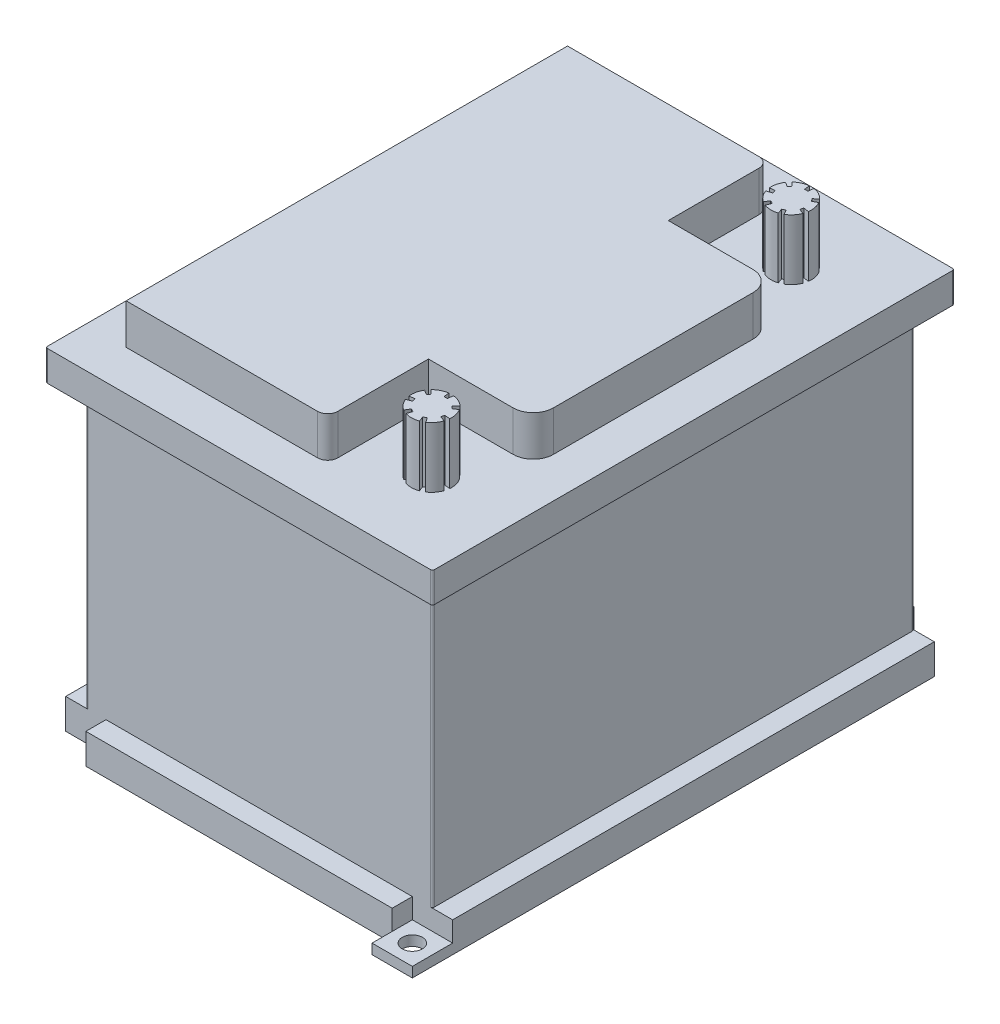
from build123d import *

# Parameters (mm, degrees)
SKETCH1_W           = 172
SKETCH1_H           = 239
BOSS_EXTRUDE1_DEPTH = 190
SKETCH2_W           = 172
SKETCH2_H           = 239
SKETCH2_W_2         = 152
SKETCH2_H_2         = 219
CUT_EXTRUDE1_DEPTH  = 20
SKETCH3_W           = 52
SKETCH3_H           = 50
CUT_EXTRUDE2_DEPTH  = 20
FILLET1_R           = 10
FILLET2_R           = 10
FILLET3_R           = 5
FILLET4_R           = 5
FILLET6_R           = 1
FILLET7_R           = 1
FILLET8_R           = 1
FILLET9_R           = 1
SKETCH4_R           = 10
BOSS_EXTRUDE4_DEPTH = 30
CUT_EXTRUDE8_START  = -30
CUT_EXTRUDE8_DEPTH  = 30
CUT_EXTRUDE9_START  = -30
CUT_EXTRUDE9_DEPTH  = 30
BOSS_EXTRUDE5_DEPTH = 15
SKETCH11_W          = 20
SKETCH11_H          = 10
CUT_EXTRUDE11_DEPTH = 15
SKETCH12_W          = 20
SKETCH12_H          = 5
BOSS_EXTRUDE6_DEPTH = 20
SKETCH13_R          = 5
CUT_EXTRUDE12_DEPTH = 20
SKETCH14_W          = 20
SKETCH14_H          = 5
BOSS_EXTRUDE7_DEPTH = 20
SKETCH15_R          = 5
CUT_EXTRUDE13_DEPTH = 20


with BuildPart() as part:
    # Sketch1 → Boss-Extrude1 (new body)
    with BuildSketch(Plane(origin=(0, 0, 0), x_dir=(1, 0, 0), z_dir=(0, 1, 0))):
        with Locations((116.427433091, -83.803086818)):
            Rectangle(SKETCH1_W, SKETCH1_H)
    extrude(amount=BOSS_EXTRUDE1_DEPTH)

    # Sketch2 → Cut-Extrude1 (cut)
    with BuildSketch(Plane(origin=(0, 190, 0), x_dir=(1, 0, 0), z_dir=(0, 1, 0))):
        with Locations((116.427433091, -83.803086818)):
            Rectangle(SKETCH2_W, SKETCH2_H)
        with Locations((116.427433091, -83.803086818)):
            Rectangle(SKETCH2_W_2, SKETCH2_H_2, mode=Mode.SUBTRACT)
    extrude(amount=-CUT_EXTRUDE1_DEPTH, mode=Mode.SUBTRACT)

    # Sketch3 → Cut-Extrude2 (cut)
    with BuildSketch(Plane(origin=(0, 190, 0), x_dir=(1, 0, 0), z_dir=(0, 1, 0))):
        with Locations((166.427433091, 0.696913182)):
            Rectangle(SKETCH3_W, SKETCH3_H)
        with Locations((166.427433091, -168.303086818)):
            Rectangle(SKETCH3_W, SKETCH3_H)
    extrude(amount=-CUT_EXTRUDE2_DEPTH, mode=Mode.SUBTRACT)

    # Fillet1
    fillet1_edges = [part.edges().sort_by_distance(p)[0] for p in [
        (192.427433091, 180, 24.303086818),
    ]]
    fillet(fillet1_edges, radius=FILLET1_R)

    # Fillet2
    fillet2_edges = [part.edges().sort_by_distance(p)[0] for p in [
        (192.427433091, 180, 143.303086818),
    ]]
    fillet(fillet2_edges, radius=FILLET2_R)

    # Fillet3
    fillet3_edges = [part.edges().sort_by_distance(p)[0] for p in [
        (140.427433091, 180, 193.303086818),
    ]]
    fillet(fillet3_edges, radius=FILLET3_R)

    # Fillet4
    fillet4_edges = [part.edges().sort_by_distance(p)[0] for p in [
        (140.427433091, 180, -25.696913182),
    ]]
    fillet(fillet4_edges, radius=FILLET4_R)

    # Fillet6
    fillet6_edges = [part.edges().sort_by_distance(p)[0] for p in [
        (30.427433091, 85, 203.303086818),
    ]]
    fillet(fillet6_edges, radius=FILLET6_R)

    # Fillet7
    fillet7_edges = [part.edges().sort_by_distance(p)[0] for p in [
        (202.427433091, 85, 203.303086818),
    ]]
    fillet(fillet7_edges, radius=FILLET7_R)

    # Fillet8
    fillet8_edges = [part.edges().sort_by_distance(p)[0] for p in [
        (202.427433091, 85, -35.696913182),
    ]]
    fillet(fillet8_edges, radius=FILLET8_R)

    # Fillet9
    fillet9_edges = [part.edges().sort_by_distance(p)[0] for p in [
        (30.427433091, 85, -35.696913182),
    ]]
    fillet(fillet9_edges, radius=FILLET9_R)

    # Sketch4 → Boss-Extrude4 (add)
    with BuildSketch(Plane(origin=(0, 170, 0), x_dir=(1, 0, 0), z_dir=(0, 1, 0))):
        with Locations(Location((171.427433091, -172.803086818, 0), (0, 0, 270))):
            Circle(SKETCH4_R)
        with Locations(Location((171.427433091, 5.696913182, 0), (0, 0, 270))):
            Circle(SKETCH4_R)
    extrude(amount=BOSS_EXTRUDE4_DEPTH)

    # Sketch7 → Cut-Extrude8 (cut)
    with BuildSketch(Plane(origin=(0, 200, 0), x_dir=(1, 0, 0), z_dir=(0, 1, 0)).offset(CUT_EXTRUDE8_START)):
        with BuildLine():
            Line((166.237215884, -167.741646234), (164.26810659, -165.821393323))
            ThreePointArc((164.26810659, -165.821393323), (163.503030714, -166.703591185), (162.846013112, -167.668962633))
            Line((162.846013112, -167.668962633), (165.181081901, -169.06599636))
            Line((165.181081901, -169.06599636), (166.237215884, -167.741646234))
        make_face()
        with BuildLine():
            Line((164.234191998, -173.705205444), (161.505158254, -174.047458976))
            ThreePointArc((161.505158254, -174.047458976), (161.71787131, -175.195660752), (162.062985325, -176.31123705))
            Line((162.062985325, -176.31123705), (164.611121852, -175.35664304))
            Line((164.611121852, -175.35664304), (164.234191998, -173.705205444))
        make_face()
        with BuildLine():
            Line((167.647825369, -178.989450929), (166.213885247, -181.336487013))
            ThreePointArc((166.213885247, -181.336487013), (167.244209965, -181.886073347), (168.331577706, -182.31180279))
            Line((168.331577706, -182.31180279), (169.173983194, -179.724409801))
            Line((169.173983194, -179.724409801), (167.647825369, -178.989450929))
        make_face()
        with BuildLine():
            ThreePointArc((174.848520104, -182.199690654), (175.920600956, -181.736811827), (176.931412335, -181.15211146))
            Line((176.931412335, -181.15211146), (175.433738269, -178.880279187))
            Line((175.433738269, -178.880279187), (173.907580445, -179.61523806))
            Line((173.907580445, -179.61523806), (174.848520104, -182.199690654))
        make_face()
        with BuildLine():
            ThreePointArc((180.907006662, -175.987059951), (181.2135449, -174.86027316), (181.386638332, -173.705434286))
            Line((181.386638332, -173.705434286), (178.676663832, -173.459898767))
            Line((178.676663832, -173.459898767), (178.299733977, -175.111336363))
            Line((178.299733977, -175.111336363), (180.907006662, -175.987059951))
        make_face()
        with BuildLine():
            ThreePointArc((179.827180973, -167.376832537), (179.137347052, -166.434631219), (178.342379652, -165.579271064))
            Line((178.342379652, -165.579271064), (176.460770789, -167.544925553))
            Line((176.460770789, -167.544925553), (177.516904772, -168.869275679))
            Line((177.516904772, -168.869275679), (179.827180973, -167.376832537))
        make_face()
        with BuildLine():
            ThreePointArc((172.422173805, -162.852685273), (171.255426737, -162.804566237), (170.091025172, -162.892788443))
            Line((170.091025172, -162.892788443), (170.454671798, -165.589455018))
            Line((170.454671798, -165.589455018), (172.148579189, -165.589455018))
            Line((172.148579189, -165.589455018), (172.422173805, -162.852685273))
        make_face()
    extrude(amount=CUT_EXTRUDE8_DEPTH, mode=Mode.SUBTRACT)

    # Sketch8 → Cut-Extrude9 (cut)
    with BuildSketch(Plane(origin=(0, 200, 0), x_dir=(1, 0, 0), z_dir=(0, 1, 0)).offset(CUT_EXTRUDE9_START)):
        with BuildLine():
            Line((166.375783325, 11.009561317), (164.536616638, 12.943750328))
            ThreePointArc((164.536616638, 12.943750328), (163.767883793, 12.125855906), (163.095653722, 11.226963141))
            Line((163.095653722, 11.226963141), (165.353867519, 9.728119429))
            Line((165.353867519, 9.728119429), (166.375783325, 11.009561317))
        make_face()
        with BuildLine():
            ThreePointArc((172.796884735, 15.60269948), (171.678132038, 15.69377019), (170.55622078, 15.658890351))
            Line((170.55622078, 15.658890351), (170.792350852, 12.95883394))
            Line((170.792350852, 12.95883394), (172.431376546, 12.95883394))
            Line((172.431376546, 12.95883394), (172.796884735, 15.60269948))
        make_face()
        with BuildLine():
            ThreePointArc((180.025927812, 10.802389509), (179.399598862, 11.733847248), (178.672828478, 12.589245565))
            Line((178.672828478, 12.589245565), (176.709064064, 10.721174005))
            Line((176.709064064, 10.721174005), (177.730979869, 9.439732117))
            Line((177.730979869, 9.439732117), (180.025927812, 10.802389509))
        make_face()
        with BuildLine():
            ThreePointArc((180.780128986, 2.15755173), (181.117862258, 3.227989823), (181.33350567, 4.329533917))
            Line((181.33350567, 4.329533917), (178.648601427, 4.700143193))
            Line((178.648601427, 4.700143193), (178.283883899, 3.102211295))
            Line((178.283883899, 3.102211295), (180.780128986, 2.15755173))
        make_face()
        with BuildLine():
            Line((164.124185412, 5.059756289), (161.465273877, 4.827784996))
            ThreePointArc((161.465273877, 4.827784996), (161.625432396, 3.716816625), (161.909086465, 2.63079552))
            Line((161.909086465, 2.63079552), (164.48890294, 3.461824392))
            Line((164.48890294, 3.461824392), (164.124185412, 5.059756289))
        make_face()
        with BuildLine():
            Line((167.37208196, -0.410256602), (165.895640195, -2.633709085))
            ThreePointArc((165.895640195, -2.633709085), (166.864087446, -3.201169563), (167.890028356, -3.656522965))
            Line((167.890028356, -3.656522965), (168.848793084, -1.121403199))
            Line((168.848793084, -1.121403199), (167.37208196, -0.410256602))
        make_face()
        with BuildLine():
            ThreePointArc((174.491559391, -3.822074685), (175.539034842, -3.418717956), (176.534708162, -2.900513255))
            Line((176.534708162, -2.900513255), (175.150451748, -0.570299486))
            Line((175.150451748, -0.570299486), (173.673740624, -1.281446083))
            Line((173.673740624, -1.281446083), (174.491559391, -3.822074685))
        make_face()
    extrude(amount=CUT_EXTRUDE9_DEPTH, mode=Mode.SUBTRACT)

    # Sketch9 → Boss-Extrude5 (add)
    with BuildSketch(Plane(origin=(0, 170, 0), x_dir=(1, 0, 0), z_dir=(0, 1, 0))):
        with BuildLine():
            Line((21.427433091, 45.696913182), (211.427433091, 45.696913182))
            ThreePointArc((211.427433091, 45.696913182), (212.134539872, 45.404019963), (212.427433091, 44.696913182))
            Line((212.427433091, 44.696913182), (212.427433091, -212.303086818))
            ThreePointArc((212.427433091, -212.303086818), (212.134539872, -213.010193599), (211.427433091, -213.303086818))
            Line((211.427433091, -213.303086818), (21.427433091, -213.303086818))
            ThreePointArc((21.427433091, -213.303086818), (20.720326309, -213.010193599), (20.427433091, -212.303086818))
            Line((20.427433091, -212.303086818), (20.427433091, 44.696913182))
            ThreePointArc((20.427433091, 44.696913182), (20.720326309, 45.404019963), (21.427433091, 45.696913182))
        make_face()
        with BuildLine():
            Line((31.427433091, 35.696913182), (201.427433091, 35.696913182))
            ThreePointArc((201.427433091, 35.696913182), (202.134539872, 35.404019963), (202.427433091, 34.696913182))
            Line((202.427433091, 34.696913182), (202.427433091, -202.303086818))
            ThreePointArc((202.427433091, -202.303086818), (202.134539872, -203.010193599), (201.427433091, -203.303086818))
            Line((201.427433091, -203.303086818), (31.427433091, -203.303086818))
            ThreePointArc((31.427433091, -203.303086818), (30.720326309, -203.010193599), (30.427433091, -202.303086818))
            Line((30.427433091, -202.303086818), (30.427433091, 34.696913182))
            ThreePointArc((30.427433091, 34.696913182), (30.720326309, 35.404019963), (31.427433091, 35.696913182))
        make_face(mode=Mode.SUBTRACT)
    boss_extrude5 = extrude(amount=-BOSS_EXTRUDE5_DEPTH)

    # Mirror2: Boss-Extrude5 across plane
    add(boss_extrude5.mirror(Plane.ZX.offset(85)))

    # Sketch11 → Cut-Extrude11 (cut)
    with BuildSketch(Plane(origin=(0, 15, 0), x_dir=(1, 0, 0), z_dir=(0, 1, 0))):
        with Locations((30.427433091, -208.303086818)):
            Rectangle(SKETCH11_W, SKETCH11_H)
        with Locations((202.427433091, -208.303086818)):
            Rectangle(SKETCH11_W, SKETCH11_H)
        with Locations((202.427433091, 40.696913182)):
            Rectangle(SKETCH11_W, SKETCH11_H)
        with Locations((30.427433091, 40.696913182)):
            Rectangle(SKETCH11_W, SKETCH11_H)
    extrude(amount=-CUT_EXTRUDE11_DEPTH, mode=Mode.SUBTRACT)

    # Sketch12 → Boss-Extrude6 (add)
    with BuildSketch(Plane.XY.offset(203.303086818)):
        with Locations((202.427433091, 2.5)):
            Rectangle(SKETCH12_W, SKETCH12_H)
    extrude(amount=BOSS_EXTRUDE6_DEPTH)

    # Sketch13 → Cut-Extrude12 (cut)
    with BuildSketch(Plane(origin=(0, 5, 0), x_dir=(1, 0, 0), z_dir=(0, 1, 0))):
        with Locations(Location((202.427433091, -213.303086818, 0), (0, 0, 270))):
            Circle(SKETCH13_R)
    extrude(amount=-CUT_EXTRUDE12_DEPTH, mode=Mode.SUBTRACT)

    # Sketch14 → Boss-Extrude7 (add)
    with BuildSketch(Plane(origin=(0, 0, -35.696913182), x_dir=(-1, 0, 0), z_dir=(0, 0, -1))):
        with Locations((-30.427433091, 2.5)):
            Rectangle(SKETCH14_W, SKETCH14_H)
    extrude(amount=BOSS_EXTRUDE7_DEPTH)

    # Sketch15 → Cut-Extrude13 (cut)
    with BuildSketch(Plane(origin=(0, 5, 0), x_dir=(1, 0, 0), z_dir=(0, 1, 0))):
        with Locations(Location((30.427433091, 45.696913182, 0), (0, 0, 270))):
            Circle(SKETCH15_R)
    extrude(amount=-CUT_EXTRUDE13_DEPTH, mode=Mode.SUBTRACT)


solid = part.part
